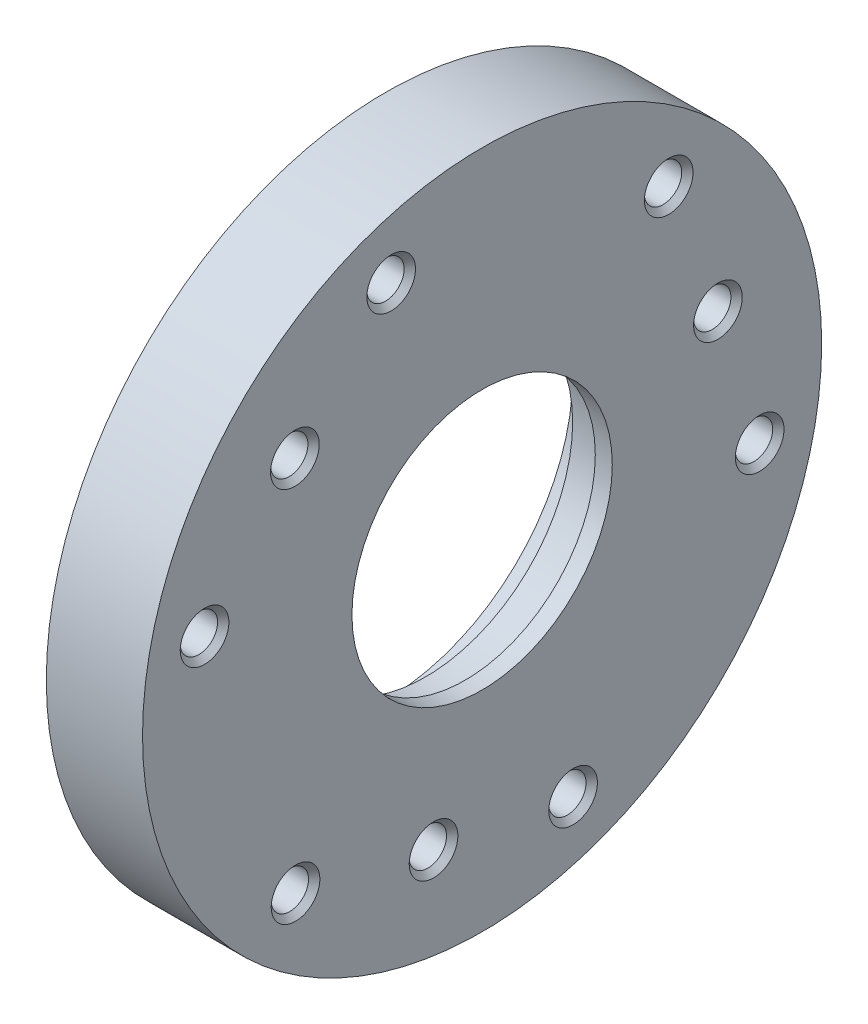
from build123d import *

# Parameters (mm, degrees)
SKETCH2_R          = 2.5
CUT_EXTRUDE1_DEPTH = 4
SKETCH3_R          = 3.075
CUT_EXTRUDE4_DEPTH = 87.539008545
SKETCH5_R          = 3.3
CUT_EXTRUDE6_DEPTH = 10
CHAMFER1_SIZE      = 1
SKETCH7_R          = 1
CUT_EXTRUDE8_DEPTH = 1


with BuildPart() as part:
    # Sketch1 → Revolve1 (revolve)
    with BuildSketch(Plane.XY, mode=Mode.PRIVATE) as revolve1_sk:
        Polygon((0, 60), (0, 33), (7, 33), (7, 26), (14, 26), (14, 23), (17, 23), (17, 60), align=None)
    revolve(revolve1_sk.sketch.rotate(Axis((0, 0, 0), (1, 0, 0)), 90), axis=Axis((0, 0, 0), (1, 0, 0)))

    # Sketch2 → Cut-Extrude1 (cut)
    with BuildSketch(Plane.ZY):
        with Locations((0, 40)):
            Circle(SKETCH2_R)
        with Locations((15.307337295, 36.9551813)):
            Circle(SKETCH2_R)
        with Locations((28.284271247, 28.284271247)):
            Circle(SKETCH2_R)
        with Locations((36.9551813, 15.307337295)):
            Circle(SKETCH2_R)
        with Locations((40, 0)):
            Circle(SKETCH2_R)
        with Locations((36.9551813, -15.307337295)):
            Circle(SKETCH2_R)
        with Locations((28.284271247, -28.284271247)):
            Circle(SKETCH2_R)
        with Locations((15.307337295, -36.9551813)):
            Circle(SKETCH2_R)
        with Locations((0, -40)):
            Circle(SKETCH2_R)
        with Locations((-15.307337295, -36.9551813)):
            Circle(SKETCH2_R)
        with Locations((-28.284271247, -28.284271247)):
            Circle(SKETCH2_R)
        with Locations((-36.9551813, -15.307337295)):
            Circle(SKETCH2_R)
        with Locations((-40, 0)):
            Circle(SKETCH2_R)
        with Locations((-36.9551813, 15.307337295)):
            Circle(SKETCH2_R)
        with Locations((-28.284271247, 28.284271247)):
            Circle(SKETCH2_R)
        with Locations((-15.307337295, 36.9551813)):
            Circle(SKETCH2_R)
    extrude(amount=-CUT_EXTRUDE1_DEPTH, mode=Mode.SUBTRACT)

    # Sketch3 → Cut-Extrude4 (cut, through all)
    with BuildSketch(Plane(origin=(17, 0, 0), x_dir=(0, 0, -1), z_dir=(1, 0, 0))):
        with Locations((49.03926402, -9.754516101)):
            Circle(SKETCH3_R)
        with Locations((16.071973265, -47.346506475)):
            Circle(SKETCH3_R)
        with Locations((-32.967290755, -37.591990374)):
            Circle(SKETCH3_R)
        with Locations((-49.03926402, 9.754516101)):
            Circle(SKETCH3_R)
        with Locations((-16.071973265, 47.346506475)):
            Circle(SKETCH3_R)
        with Locations((32.967290755, 37.591990374)):
            Circle(SKETCH3_R)
    extrude(amount=-CUT_EXTRUDE4_DEPTH, mode=Mode.SUBTRACT)

    # Sketch5 → Cut-Extrude6 (cut)
    with BuildSketch(Plane(origin=(17, 0, 0), x_dir=(0, 0, -1), z_dir=(1, 0, 0))):
        with Locations((32.967290755, 37.591990374)):
            Circle(SKETCH5_R)
        with Locations((49.03926402, -9.754516101)):
            Circle(SKETCH5_R)
        with Locations((16.071973265, -47.346506475)):
            Circle(SKETCH5_R)
        with Locations((-32.967290755, -37.591990374)):
            Circle(SKETCH5_R)
        with Locations((-49.03926402, 9.754516101)):
            Circle(SKETCH5_R)
        with Locations((-16.071973265, 47.346506475)):
            Circle(SKETCH5_R)
        with Locations((41.664925698, 14.143336473)):
            Circle(SKETCH5_R)
        with Locations((-8.583974169, -43.154552338)):
            Circle(SKETCH5_R)
        with Locations((-33.080951529, 29.011215864)):
            Circle(SKETCH5_R)
    extrude(amount=-CUT_EXTRUDE6_DEPTH, mode=Mode.SUBTRACT)

    # Chamfer1
    chamfer1_edges = [part.edges().sort_by_distance(p)[0] for p in [
        (17, -9.754516101, -45.73926402),
        (17, -47.346506475, -12.771973265),
        (17, -37.591990374, 36.267290755),
        (17, 9.754516101, 52.33926402),
        (17, 29.011215864, 36.380951529),
        (17, -43.154552338, 11.883974169),
        (17, 14.143336473, -38.364925698),
        (17, 47.346506475, 19.371973265),
        (17, 37.591990374, -29.667290755),
    ]]
    chamfer(chamfer1_edges, length=CHAMFER1_SIZE)

    # Sketch7 → Cut-Extrude8 (cut)
    with BuildSketch(Plane.ZY):
        with Locations((39.086428505, -31.895390573)):
            Circle(SKETCH7_R)
    extrude(amount=-CUT_EXTRUDE8_DEPTH, mode=Mode.SUBTRACT)


solid = part.part
